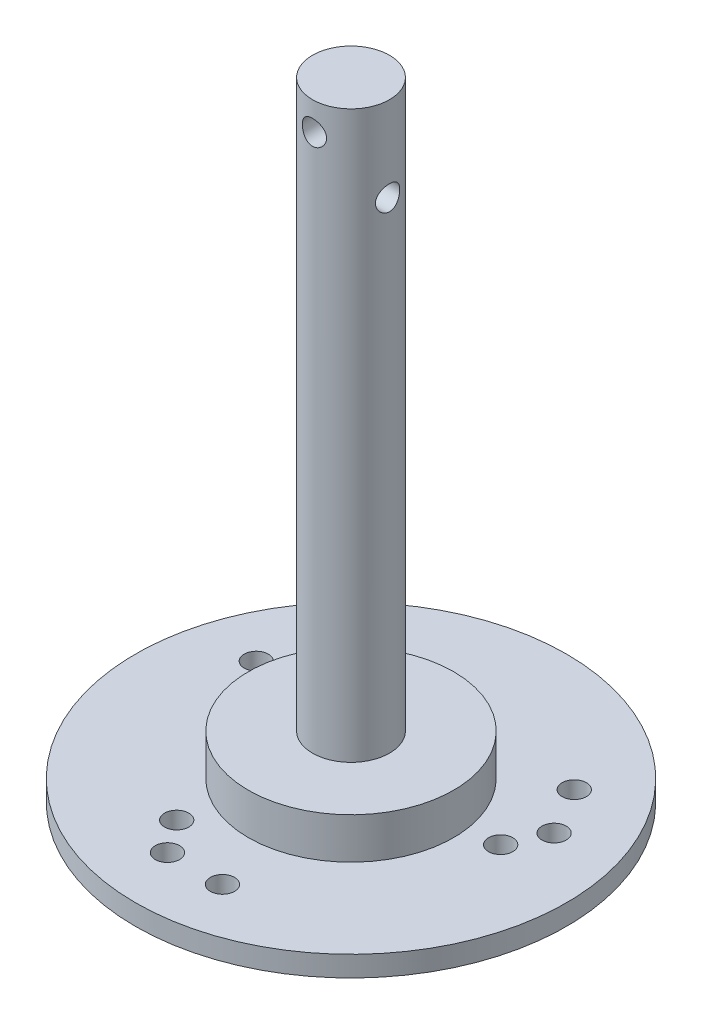
from build123d import *

# Parameters (mm, degrees)
SKETCH1_R               = 26.65
BOSS_EXTRUDE1_DEPTH     = 2.54
SKETCH2_R               = 12.7
BOSS_EXTRUDE2_DEPTH     = 5.08
SKETCH4_R               = 4.7625
BOSS_EXTRUDE3_DEPTH     = 70
SKETCH6_R               = 1.5
CUT_EXTRUDE2_DEPTH      = 87.286206314
CUT_EXTRUDE3_DEPTH      = 87.286206314
CUT_EXTRUDE3_DEPTH_BACK = 87.286206314
SKETCH7_R               = 1.5
CUT_EXTRUDE4_DEPTH      = 87.286206404
CUT_EXTRUDE4_DEPTH_BACK = 87.286206404
SKETCH8_R               = 1.5


with BuildPart() as part:
    # Sketch1 → Boss-Extrude1 (new body)
    with BuildSketch(Plane(origin=(0, 0, 0), x_dir=(1, 0, 0), z_dir=(0, 1, 0))):
        with Locations(Location((0, 0, 0), (0, 0, 270))):
            Circle(SKETCH1_R)
    extrude(amount=BOSS_EXTRUDE1_DEPTH)

    # Sketch2 → Boss-Extrude2 (add)
    with BuildSketch(Plane(origin=(0, 2.54, 0), x_dir=(1, 0, 0), z_dir=(0, 1, 0))):
        with Locations(Location((0, 0, 0), (0, 0, 270))):
            Circle(SKETCH2_R)
    extrude(amount=BOSS_EXTRUDE2_DEPTH)

    # Sketch4 → Boss-Extrude3 (add)
    with BuildSketch(Plane(origin=(0, 7.62, 0), x_dir=(1, 0, 0), z_dir=(0, 1, 0))):
        with Locations(Location((0, 0, 0), (0, 0, 270))):
            Circle(SKETCH4_R)
    extrude(amount=BOSS_EXTRUDE3_DEPTH)

    # Sketch6 → Cut-Extrude2 (cut, through all)
    with BuildSketch(Plane(origin=(0, 0, 0), x_dir=(-1, 0, 0), z_dir=(0, -1, 0))):
        with Locations(Location((6.313805851, -15.242875716, 0), (0, 0, 90))):
            Circle(SKETCH6_R)
        with Locations(Location((-16.357620523, 2.153521596, 0), (0, 0, 90))):
            Circle(SKETCH6_R)
        with Locations(Location((10.043814672, 13.08935412, 0), (0, 0, 90))):
            Circle(SKETCH6_R)
        with Locations(Location((-3.403504282, -19.302231959, 0), (0, 0, 90))):
            Circle(SKETCH6_R)
        with Locations(Location((-18.417975367, 6.703594809, 0), (0, 0, 90))):
            Circle(SKETCH6_R)
        with Locations(Location((-15.014471085, 12.59863715, 0), (0, 0, 90))):
            Circle(SKETCH6_R)
        with Locations(Location((15.014471085, 12.59863715, 0), (0, 0, 90))):
            Circle(SKETCH6_R)
        with Locations(Location((18.417975367, 6.703594809, 0), (0, 0, 90))):
            Circle(SKETCH6_R)
        with Locations(Location((3.403504282, -19.302231959, 0), (0, 0, 90))):
            Circle(SKETCH6_R)
    extrude(amount=-CUT_EXTRUDE2_DEPTH, mode=Mode.SUBTRACT)

    # Sketch7 → Cut-Extrude3 (cut, two sides: drawn at the far end of the back side and taken through both)
    with BuildSketch(Plane.XY.offset(-CUT_EXTRUDE3_DEPTH_BACK)):
        with Locations(Location((0, 74.12, 0), (0, 0, 90.00000001))):
            Circle(SKETCH7_R)
    extrude(amount=CUT_EXTRUDE3_DEPTH + CUT_EXTRUDE3_DEPTH_BACK, mode=Mode.SUBTRACT)

    # Sketch8 → Cut-Extrude4 (cut, two sides: drawn at the far end of the back side and taken through both)
    with BuildSketch(Plane(origin=(0, 0, 0), x_dir=(0, 0, -1), z_dir=(1, 0, 0)).offset(-CUT_EXTRUDE4_DEPTH_BACK)):
        with Locations((0, 67.12)):
            Circle(SKETCH8_R)
    extrude(amount=CUT_EXTRUDE4_DEPTH + CUT_EXTRUDE4_DEPTH_BACK, mode=Mode.SUBTRACT)


solid = part.part
